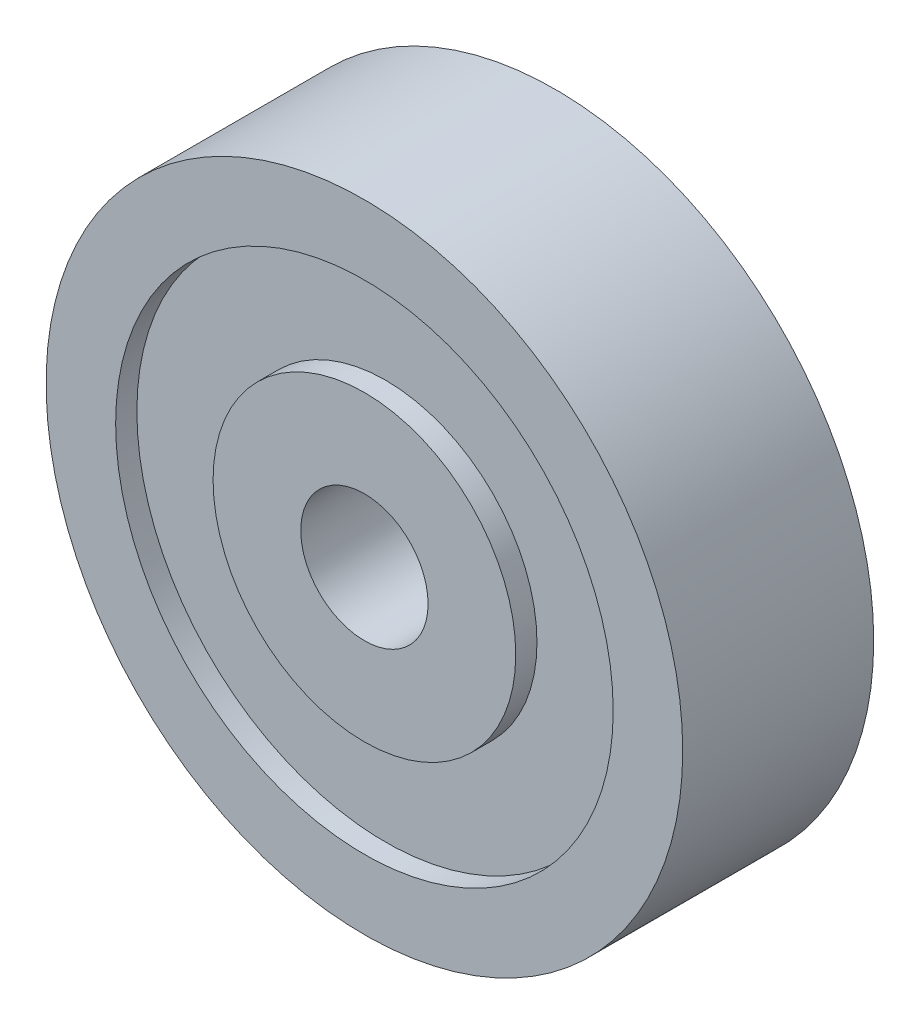
from build123d import *

# Parameters (mm, degrees)
SKETCH_1_R          = 15
SKETCH_1_R_2        = 3
EXTRUDE_1_DEPTH     = 9
SKETCH_2_R          = 11.723129436
SKETCH_2_R_2        = 7.131561965
CUT_EXTRUDE_1_DEPTH = 1


with BuildPart() as part:
    # 草图1 → 凸台-拉伸1 (new body)
    with BuildSketch(Plane.XY):
        Circle(SKETCH_1_R)
        Circle(SKETCH_1_R_2, mode=Mode.SUBTRACT)
    extrude(amount=EXTRUDE_1_DEPTH)

    # 草图2 → 切除-拉伸1 (cut)
    with BuildSketch(Plane(origin=(0, 0, 0), x_dir=(-1, 0, 0), z_dir=(0, 0, -1))):
        Circle(SKETCH_2_R)
        Circle(SKETCH_2_R_2, mode=Mode.SUBTRACT)
    cut_extrude_1 = extrude(amount=-CUT_EXTRUDE_1_DEPTH, mode=Mode.SUBTRACT)

    # 镜向1: 切除-拉伸1 across plane
    add(cut_extrude_1.mirror(Plane(origin=(0, 0, 4.5), x_dir=(1, 0, 0), z_dir=(0, 0, -1))), mode=Mode.SUBTRACT)


solid = part.part
